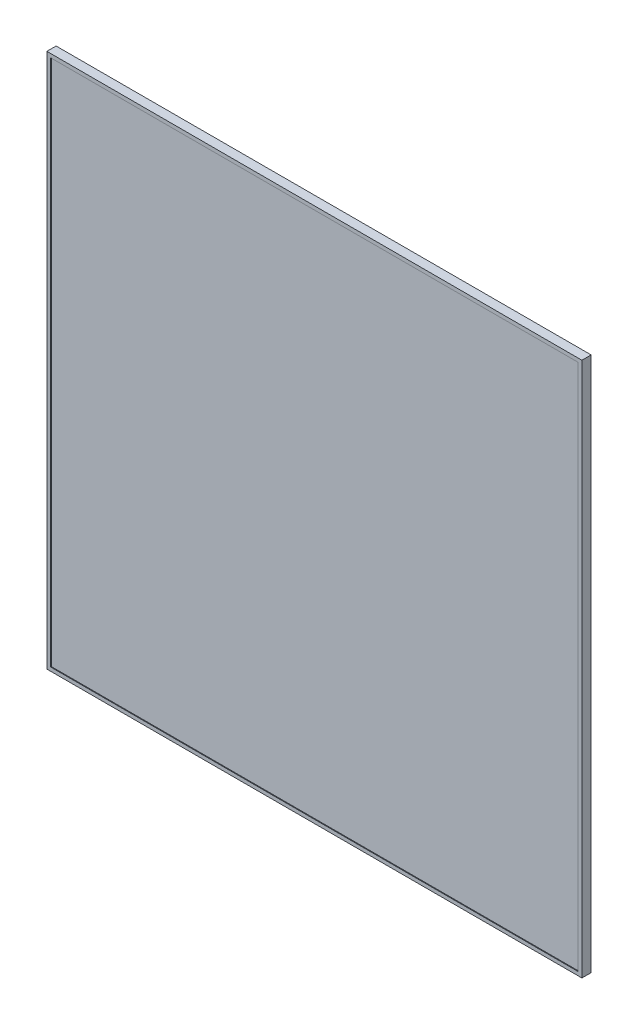
from build123d import *

# Parameters (mm, degrees)
SKETCH1_W           = 145
SKETCH1_H           = 145
BOSS_EXTRUDE1_DEPTH = 1.25
SKETCH2_W           = 143
SKETCH2_H           = 143
CUT_EXTRUDE1_DEPTH  = 0.2


with BuildPart() as part:
    # Sketch1 → Boss-Extrude1 (new, symmetric)
    with BuildSketch(Plane.XY):
        Rectangle(SKETCH1_W, SKETCH1_H)
    extrude(amount=BOSS_EXTRUDE1_DEPTH, both=True)

    # Sketch2 → Cut-Extrude1 (cut)
    with BuildSketch(Plane.XY.offset(1.25)):
        Rectangle(SKETCH2_W, SKETCH2_H)
    extrude(amount=-CUT_EXTRUDE1_DEPTH, mode=Mode.SUBTRACT)


solid = part.part
